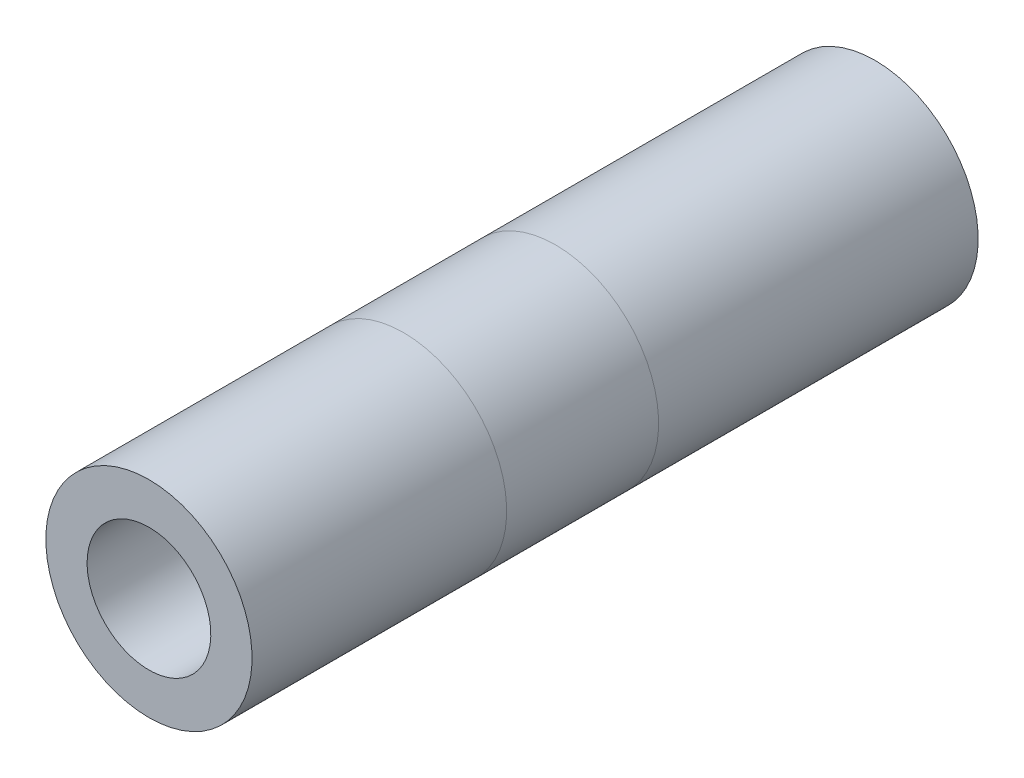
from build123d import *

# Parameters (mm, degrees)
SWEEP1_PROFILE_R     = 7.9375
CUT_SWEEP1_PROFILE_R = 4.7625


with BuildPart() as part:
    # Sweep1: sweep along a curve in space
    with BuildLine() as sweep1_path:
        Line((-46.03, 0, -24.6), (-46.03, 0, 0))
        Line((-46.03, 0, 0), (-46.03, 0, 11.700046958))
        Line((-46.03, 0, 31.301626468), (-46.03, 0, 11.700046958))
    # Sweep1 profile (on start of the path) → Sweep1 (sweep)
    with BuildSketch(Plane(origin=(-46.03, 0, -24.6), x_dir=(1, 0, 0), z_dir=(0, 0, 1))):
        Circle(SWEEP1_PROFILE_R)
    sweep(path=sweep1_path.line)

    # Cut-Sweep1: sweep along a curve in space
    with BuildLine() as cut_sweep1_path:
        Line((-46.03, 0, -24.6), (-46.03, 0, 0))
        Line((-46.03, 0, 0), (-46.03, 0, 11.700046958))
        Line((-46.03, 0, 31.301626468), (-46.03, 0, 11.700046958))
    # Cut-Sweep1 profile (on start of the path) → Cut-Sweep1 (sweep, cut)
    with BuildSketch(Plane(origin=(-46.03, 0, -24.6), x_dir=(1, 0, 0), z_dir=(0, 0, 1))):
        Circle(CUT_SWEEP1_PROFILE_R)
    sweep(path=cut_sweep1_path.line, mode=Mode.SUBTRACT)


solid = part.part
